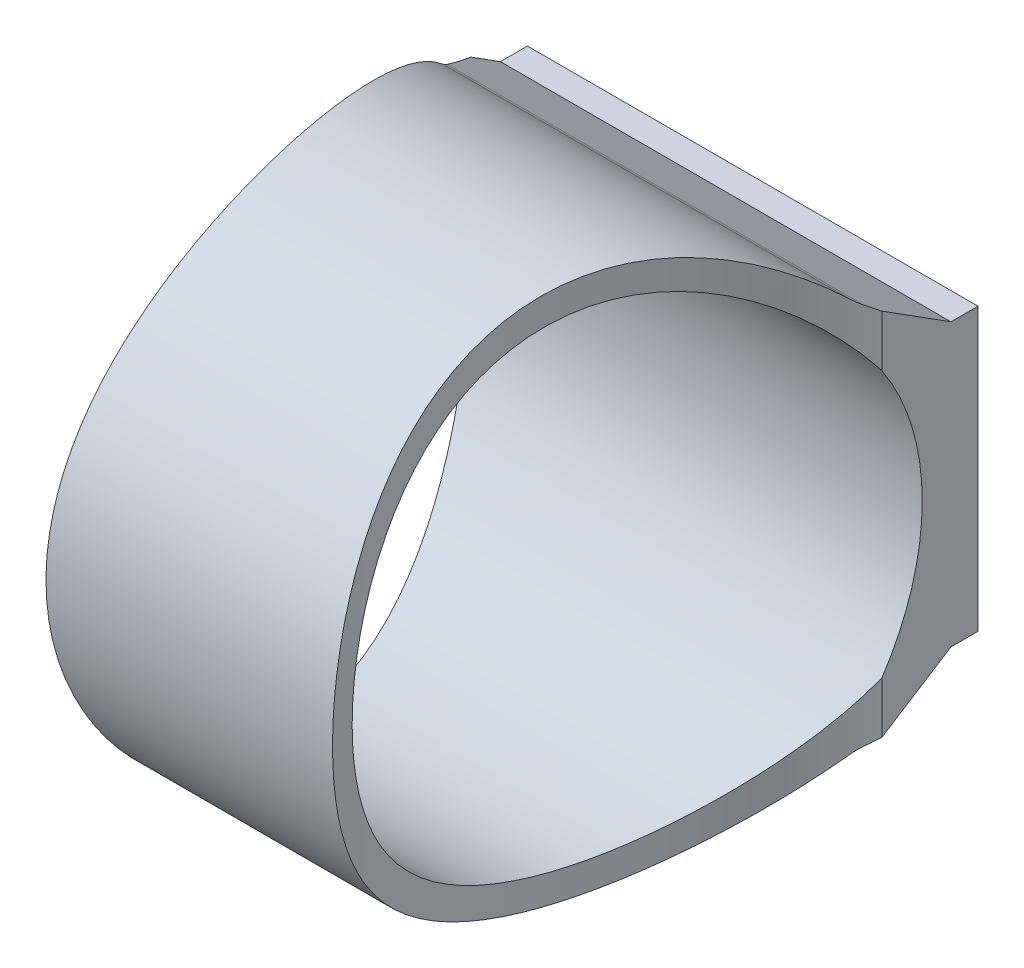
from build123d import *

# Parameters (mm, degrees)
SKETCH1_R               = 60.325
SKETCH1_R_2             = 53.975
BOSS_EXTRUDE1_DEPTH     = 101.6
FILLET3_R               = 12.7
CUT_EXTRUDE2_DEPTH      = 136.610847387
CUT_EXTRUDE2_DEPTH_BACK = 136.610847387


with BuildPart() as part:
    # Sketch1 → Boss-Extrude1 (new body)
    # profile 1 of 2: a face of its own
    with BuildSketch(Plane(origin=(0, 0, 0), x_dir=(0, 0, -1), z_dir=(1, 0, 0))):
        with BuildLine():
            Line((66.548, 31.75), (60.452, 31.75))
            Line((60.452, 31.75), (41.582779106, 43.703296292))
            ThreePointArc((41.582779106, 43.703296292), (55.441801804, 23.776295711), (60.325, 0))
            ThreePointArc((60.325, 0), (55.441801804, -23.776295711), (41.582779106, -43.703296292))
            Line((41.582779106, -43.703296292), (60.452, -31.75))
            Line((60.452, -31.75), (66.548, -31.75))
            Line((66.548, -31.75), (66.548, 31.75))
        make_face()
    # profile 2 of 2: a face of its own
    with BuildSketch(Plane(origin=(0, 0, 0), x_dir=(0, 0, -1), z_dir=(1, 0, 0))):
        Circle(SKETCH1_R)
        Circle(SKETCH1_R_2, mode=Mode.SUBTRACT)
    extrude(amount=BOSS_EXTRUDE1_DEPTH)

    # Fillet3
    fillet3_edges = [part.edges().sort_by_distance(p)[0] for p in [
        (50.8, -43.703296292, -41.582779106),
        (50.8, 43.703296292, -41.582779106),
    ]]
    fillet(fillet3_edges, radius=FILLET3_R)

    # Sketch3 → Cut-Extrude2 (cut, two sides: drawn at the far end of the back side and taken through both)
    with BuildSketch(Plane(origin=(0, 0, 0), x_dir=(1, 0, 0), z_dir=(0, 1, 0)).offset(-CUT_EXTRUDE2_DEPTH_BACK)):
        with BuildLine():
            Line((-10.157501367, 69.371411559), (-19.945541418, 96.449034115))
            Line((-19.945541418, 96.449034115), (-19.945541418, -173.768884202))
            Line((-19.945541418, -173.768884202), (157.676309373, -157.23901293))
            Line((157.676309373, -157.23901293), (148.297284667, 47.894894174))
            Line((148.297284667, 47.894894174), (143.476168145, 77.107572373))
            ThreePointArc((143.476168145, 77.107572373), (86.598799566, 20.112057795), (82.937724358, -60.325))
            Line((82.937724358, -60.325), (12.253132086, -82.144467522))
            ThreePointArc((12.253132086, -82.144467522), (19.894210891, -3.598967597), (-10.157501367, 69.371411559))
        make_face()
    extrude(amount=CUT_EXTRUDE2_DEPTH + CUT_EXTRUDE2_DEPTH_BACK, mode=Mode.SUBTRACT)


solid = part.part
